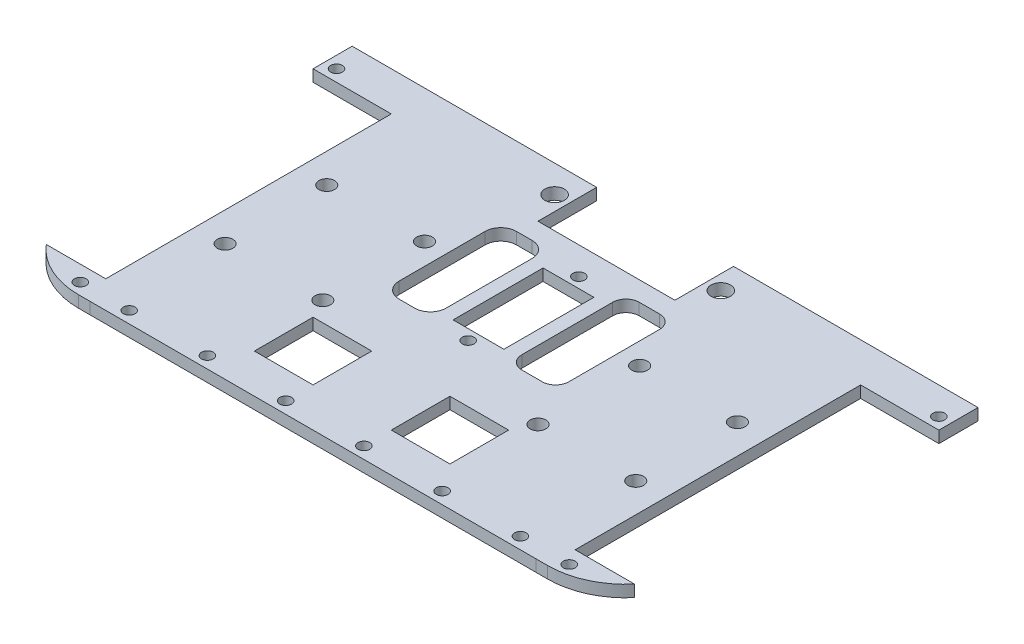
from build123d import *

# Parameters (mm, degrees)
CROQUIS1_R              = 2.5
CROQUIS1_R_2            = 2
CROQUIS1_R_3            = 1.5
CROQUIS1_W              = 13
CROQUIS1_H              = 23
CROQUIS1_W_2            = 15
CROQUIS1_H_2            = 15
SALIENTE_EXTRUIR1_DEPTH = 3
CROQUIS2_W              = 20
CROQUIS2_H              = 72.999
CORTAR_EXTRUIR1_DEPTH   = 10
CROQUIS3_W              = 35
CROQUIS3_H              = 15
CORTAR_EXTRUIR2_DEPTH   = 10
CROQUIS4_R              = 1.5
CORTAR_EXTRUIR3_DEPTH   = 10
CORTAR_EXTRUIR4_DEPTH   = 10


with BuildPart() as part:
    # Croquis1 → Saliente-Extruir1 (new body)
    with BuildSketch(Plane(origin=(0, 0, 0), x_dir=(1, 0, 0), z_dir=(0, 1, 0))):
        with BuildLine():
            Line((0, 0), (-160, 0))
            Line((-160, 0), (-160, -70))
            ThreePointArc((-160, -70), (-154.142135624, -84.142135624), (-140, -90))
            Line((-140, -90), (-137, -90))
            Line((-137, -90), (-137, -89.999))
            Line((-137, -89.999), (-23, -89.999))
            Line((-23, -89.999), (-23, -90))
            Line((-23, -90), (-20, -90))
            ThreePointArc((-20, -90), (-5.857864376, -84.142135624), (0, -70))
            Line((0, -70), (0, 0))
        make_face()
        with Locations(Location((-101.245, -7, 0), (0, 0, 270))):
            Circle(CROQUIS1_R, mode=Mode.SUBTRACT)
        with Locations(Location((-58.755, -7, 0), (0, 0, 270))):
            Circle(CROQUIS1_R, mode=Mode.SUBTRACT)
        with Locations(Location((-27.5, -60, 0), (0, 0, 270))):
            Circle(CROQUIS1_R_2, mode=Mode.SUBTRACT)
        with Locations(Location((-52.5, -60, 0), (0, 0, 270))):
            Circle(CROQUIS1_R_2, mode=Mode.SUBTRACT)
        with Locations(Location((-27.5, -34, 0), (0, 0, 270))):
            Circle(CROQUIS1_R_2, mode=Mode.SUBTRACT)
        with Locations(Location((-52.5, -34, 0), (0, 0, 270))):
            Circle(CROQUIS1_R_2, mode=Mode.SUBTRACT)
        with Locations(Location((-107.5, -34, 0), (0, 0, 270))):
            Circle(CROQUIS1_R_2, mode=Mode.SUBTRACT)
        with Locations(Location((-132.5, -34, 0), (0, 0, 270))):
            Circle(CROQUIS1_R_2, mode=Mode.SUBTRACT)
        with Locations(Location((-132.5, -60, 0), (0, 0, 270))):
            Circle(CROQUIS1_R_2, mode=Mode.SUBTRACT)
        with Locations(Location((-107.5, -60, 0), (0, 0, 270))):
            Circle(CROQUIS1_R_2, mode=Mode.SUBTRACT)
        with Locations(Location((-80, -22.054, 0), (0, 0, 270))):
            Circle(CROQUIS1_R_3, mode=Mode.SUBTRACT)
        with Locations(Location((-80, -50.344, 0), (0, 0, 270))):
            Circle(CROQUIS1_R_3, mode=Mode.SUBTRACT)
        with Locations((-80, -36.199)):
            Rectangle(CROQUIS1_W, CROQUIS1_H, mode=Mode.SUBTRACT)
        with Locations((-97.5, -72.499)):
            Rectangle(CROQUIS1_W_2, CROQUIS1_H_2, mode=Mode.SUBTRACT)
        with Locations((-62.5, -72.499)):
            Rectangle(CROQUIS1_W_2, CROQUIS1_H_2, mode=Mode.SUBTRACT)
    extrude(amount=SALIENTE_EXTRUIR1_DEPTH)

    # Croquis2 → Cortar-Extruir1 (cut)
    with BuildSketch(Plane(origin=(0, 3, 0), x_dir=(1, 0, 0), z_dir=(0, 1, 0))):
        with Locations((-150, -46.4995)):
            Rectangle(CROQUIS2_W, CROQUIS2_H)
        with Locations((-10, -46.4995)):
            Rectangle(CROQUIS2_W, CROQUIS2_H)
    extrude(amount=-CORTAR_EXTRUIR1_DEPTH, mode=Mode.SUBTRACT)

    # Croquis3 → Cortar-Extruir2 (cut)
    with BuildSketch(Plane.XZ):
        with Locations((-80, 7.5)):
            Rectangle(CROQUIS3_W, CROQUIS3_H)
    extrude(amount=-CORTAR_EXTRUIR2_DEPTH, mode=Mode.SUBTRACT)

    # Croquis4 → Cortar-Extruir3 (cut)
    with BuildSketch(Plane(origin=(0, 0, 0), x_dir=(-1, 0, 0), z_dir=(0, -1, 0))):
        with Locations(Location((157, -7, 0), (0, 0, 90))):
            Circle(CROQUIS4_R)
        with Locations(Location((3, -7, 0), (0, 0, 90))):
            Circle(CROQUIS4_R)
        with Locations(Location((30, -86.999, 0), (0, 0, 90))):
            Circle(CROQUIS4_R)
        with Locations(Location((50, -86.999, 0), (0, 0, 90))):
            Circle(CROQUIS4_R)
        with Locations(Location((70, -86.999, 0), (0, 0, 90))):
            Circle(CROQUIS4_R)
        with Locations(Location((130, -86.999, 0), (0, 0, 90))):
            Circle(CROQUIS4_R)
        with Locations(Location((90, -86.999, 0), (0, 0, 90))):
            Circle(CROQUIS4_R)
        with Locations(Location((110, -86.999, 0), (0, 0, 90))):
            Circle(CROQUIS4_R)
        with Locations(Location((142.5, -86.999, 0), (0, 0, 90))):
            Circle(CROQUIS4_R)
        with Locations(Location((17.5, -86.999, 0), (0, 0, 90))):
            Circle(CROQUIS4_R)
    extrude(amount=-CORTAR_EXTRUIR3_DEPTH, mode=Mode.SUBTRACT)

    # Croquis5 → Cortar-Extruir4 (cut)
    with BuildSketch(Plane(origin=(0, 0, 0), x_dir=(-1, 0, 0), z_dir=(0, -1, 0))):
        with BuildLine():
            Line((98, -50), (94, -50))
            ThreePointArc((94, -50), (91.171572875, -48.828427125), (90, -46))
            Line((90, -46), (90, -24))
            ThreePointArc((90, -24), (91.171572875, -21.171572875), (94, -20))
            Line((94, -20), (98, -20))
            ThreePointArc((98, -20), (100.828427125, -21.171572875), (102, -24))
            Line((102, -24), (102, -46))
            ThreePointArc((102, -46), (100.828427125, -48.828427125), (98, -50))
        make_face()
        with BuildLine():
            Line((66.613773368, -50), (61.386226632, -50))
            ThreePointArc((61.386226632, -50), (58.991802818, -49.008197182), (58, -46.613773368))
            Line((58, -46.613773368), (58, -23.386226632))
            ThreePointArc((58, -23.386226632), (58.991802818, -20.991802818), (61.386226632, -20))
            Line((61.386226632, -20), (66.613773368, -20))
            ThreePointArc((66.613773368, -20), (69.008197182, -20.991802818), (70, -23.386226632))
            Line((70, -23.386226632), (70, -46.613773368))
            ThreePointArc((70, -46.613773368), (69.008197182, -49.008197182), (66.613773368, -50))
        make_face()
    extrude(amount=-CORTAR_EXTRUIR4_DEPTH, mode=Mode.SUBTRACT)


solid = part.part
